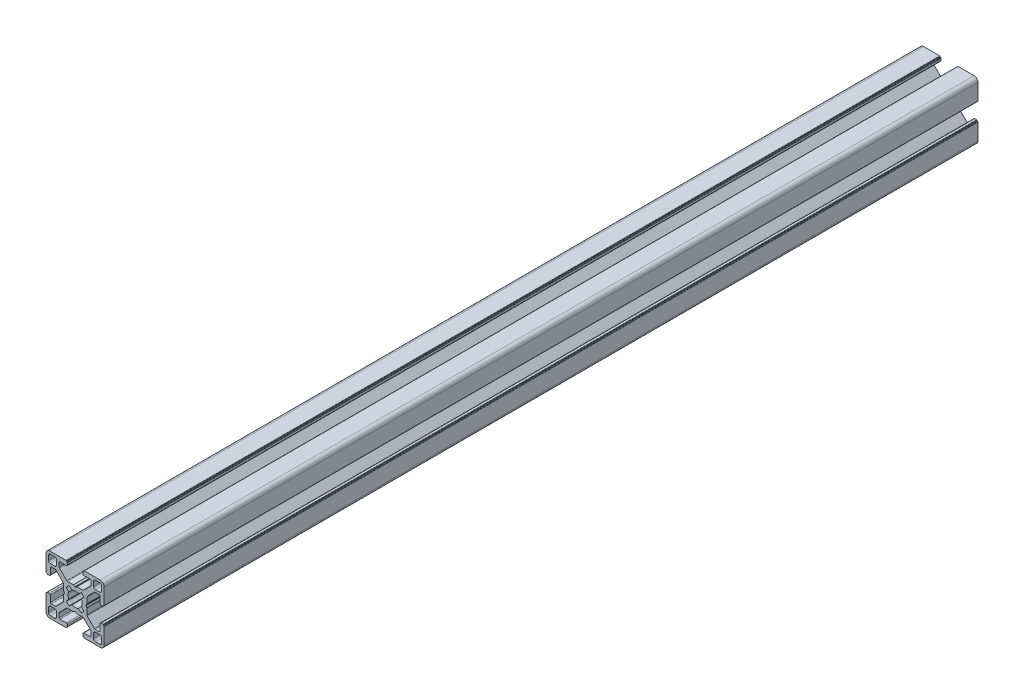
from build123d import *

# Parameters (mm, degrees)
SALIENTE_EXTRUIR1_DEPTH = 1000
CORTAR_EXTRUIR1_START   = -550
CORTAR_EXTRUIR1_DEPTH   = 550


with BuildPart() as part:
    # Croquis1 → Saliente-Extruir1 (new body)
    with BuildSketch(Plane.XY.offset(1000)):
        with BuildLine():
            Line((9.800000436, -10.500000436), (10.100000436, -10.500000436))
            ThreePointArc((10.100000436, -10.500000436), (10.241421792, -10.441421792), (10.300000436, -10.300000436))
            Line((10.300000436, -10.300000436), (10.300000436, -2))
            ThreePointArc((10.300000436, -2), (9.714213998, -0.585786438), (8.300000436, 0))
            Line((8.300000436, 0), (0, 0))
            ThreePointArc((0, 0), (-0.141421356, -0.058578644), (-0.2, -0.2))
            Line((-0.2, -0.2), (-0.2, -0.5))
            Line((-0.2, -0.5), (-0.49999919, -0.5))
            ThreePointArc((-0.49999919, -0.5), (-0.641420811, -0.558578753), (-0.699999564, -0.700000374))
            Line((-0.699999564, -0.700000374), (-0.699999564, -1.700000763))
            ThreePointArc((-0.699999564, -1.700000763), (-0.553552955, -2.053554154), (-0.199999564, -2.200000763))
            Line((-0.199999564, -2.200000763), (3.050000763, -2.200000763))
            ThreePointArc((3.050000763, -2.200000763), (3.403554154, -2.346447372), (3.550000763, -2.700000763))
            Line((3.550000763, -2.700000763), (3.550000763, -4.743055509))
            ThreePointArc((3.550000763, -4.743055509), (3.511993279, -4.934269826), (3.403749103, -5.096413843))
            Line((3.403749103, -5.096413843), (-0.349053376, -8.853358334))
            ThreePointArc((-0.349053376, -8.853358334), (-0.511332616, -8.961886981), (-0.702801716, -9))
            Line((-0.702801716, -9), (-3.746809419, -9))
            ThreePointArc((-3.746809419, -9), (-3.798212795, -9.006718618), (-3.846162576, -9.026423071))
            Line((-3.846162576, -9.026423071), (-4.600646407, -9.458279719))
            ThreePointArc((-4.600646407, -9.458279719), (-4.699999564, -9.48470279), (-4.799352721, -9.458279719))
            Line((-4.799352721, -9.458279719), (-5.553836552, -9.026423071))
            ThreePointArc((-5.553836552, -9.026423071), (-5.601786333, -9.006718618), (-5.653189709, -9))
            Line((-5.653189709, -9), (-8.697197412, -9))
            ThreePointArc((-8.697197412, -9), (-8.888666513, -8.961886981), (-9.050945752, -8.853358334))
            Line((-9.050945752, -8.853358334), (-12.803748231, -5.096413843))
            ThreePointArc((-12.803748231, -5.096413843), (-12.911992407, -4.934269826), (-12.949999891, -4.743055509))
            Line((-12.949999891, -4.743055509), (-12.949999891, -2.700000763))
            ThreePointArc((-12.949999891, -2.700000763), (-12.803553282, -2.346447372), (-12.449999891, -2.200000763))
            Line((-12.449999891, -2.200000763), (-9.199999564, -2.200000763))
            ThreePointArc((-9.199999564, -2.200000763), (-8.846446173, -2.053554154), (-8.699999564, -1.700000763))
            Line((-8.699999564, -1.700000763), (-8.699999564, -0.700000374))
            ThreePointArc((-8.699999564, -0.700000374), (-8.758578317, -0.558578753), (-8.899999938, -0.5))
            Line((-8.899999938, -0.5), (-9.199999128, -0.5))
            Line((-9.199999128, -0.5), (-9.199999128, -0.2))
            ThreePointArc((-9.199999128, -0.2), (-9.258577772, -0.058578644), (-9.399999128, 0))
            Line((-9.399999128, 0), (-17.699999564, 0))
            ThreePointArc((-17.699999564, 0), (-19.114213126, -0.585786438), (-19.699999564, -2))
            Line((-19.699999564, -2), (-19.699999564, -10.300000436))
            ThreePointArc((-19.699999564, -10.300000436), (-19.64142092, -10.441421792), (-19.499999564, -10.500000436))
            Line((-19.499999564, -10.500000436), (-19.199999564, -10.500000436))
            Line((-19.199999564, -10.500000436), (-19.199999564, -10.799999627))
            ThreePointArc((-19.199999564, -10.799999627), (-19.141420811, -10.941421247), (-18.99999919, -11))
            Line((-18.99999919, -11), (-17.999998801, -11))
            ThreePointArc((-17.999998801, -11), (-17.64644541, -10.853553391), (-17.499998801, -10.5))
            Line((-17.499998801, -10.5), (-17.499998801, -7.249999673))
            ThreePointArc((-17.499998801, -7.249999673), (-17.353552192, -6.896446283), (-16.999998801, -6.749999673))
            Line((-16.999998801, -6.749999673), (-14.956944055, -6.749999673))
            ThreePointArc((-14.956944055, -6.749999673), (-14.765729738, -6.788007157), (-14.603585721, -6.896251334))
            Line((-14.603585721, -6.896251334), (-10.84664123, -10.649053813))
            ThreePointArc((-10.84664123, -10.649053813), (-10.738112583, -10.811333052), (-10.699999564, -11.002802152))
            Line((-10.699999564, -11.002802152), (-10.699999564, -14.046809855))
            ThreePointArc((-10.699999564, -14.046809855), (-10.693280947, -14.098213232), (-10.673576493, -14.146163012))
            Line((-10.673576493, -14.146163012), (-10.241719845, -14.900646843))
            ThreePointArc((-10.241719845, -14.900646843), (-10.215296774, -15), (-10.241719845, -15.099353157))
            Line((-10.241719845, -15.099353157), (-10.673576493, -15.853836988))
            ThreePointArc((-10.673576493, -15.853836988), (-10.693280947, -15.901786769), (-10.699999564, -15.953190146))
            Line((-10.699999564, -15.953190146), (-10.699999564, -18.997197848))
            ThreePointArc((-10.699999564, -18.997197848), (-10.738112583, -19.188666949), (-10.84664123, -19.350946188))
            Line((-10.84664123, -19.350946188), (-14.603585721, -23.103748667))
            ThreePointArc((-14.603585721, -23.103748667), (-14.765729738, -23.211992843), (-14.956944055, -23.250000327))
            Line((-14.956944055, -23.250000327), (-16.999998801, -23.250000327))
            ThreePointArc((-16.999998801, -23.250000327), (-17.353552192, -23.103553718), (-17.499998801, -22.750000327))
            Line((-17.499998801, -22.750000327), (-17.499998801, -19.5))
            ThreePointArc((-17.499998801, -19.5), (-17.64644541, -19.14644661), (-17.999998801, -19))
            Line((-17.999998801, -19), (-18.99999919, -19))
            ThreePointArc((-18.99999919, -19), (-19.141420811, -19.058578753), (-19.199999564, -19.200000374))
            Line((-19.199999564, -19.200000374), (-19.199999564, -19.499999564))
            Line((-19.199999564, -19.499999564), (-19.499999564, -19.499999564))
            ThreePointArc((-19.499999564, -19.499999564), (-19.64142092, -19.558578208), (-19.699999564, -19.699999564))
            Line((-19.699999564, -19.699999564), (-19.699999564, -28))
            ThreePointArc((-19.699999564, -28), (-19.114213126, -29.414213563), (-17.699999564, -30))
            Line((-17.699999564, -30), (-9.399999128, -30))
            ThreePointArc((-9.399999128, -30), (-9.258577772, -29.941421356), (-9.199999128, -29.8))
            Line((-9.199999128, -29.8), (-9.199999128, -29.5))
            Line((-9.199999128, -29.5), (-8.899999938, -29.5))
            ThreePointArc((-8.899999938, -29.5), (-8.758578317, -29.441421247), (-8.699999564, -29.299999627))
            Line((-8.699999564, -29.299999627), (-8.699999564, -28.299999237))
            ThreePointArc((-8.699999564, -28.299999237), (-8.846446173, -27.946445847), (-9.199999564, -27.799999237))
            Line((-9.199999564, -27.799999237), (-12.449999891, -27.799999237))
            ThreePointArc((-12.449999891, -27.799999237), (-12.803553282, -27.653552628), (-12.949999891, -27.299999237))
            Line((-12.949999891, -27.299999237), (-12.949999891, -25.256944491))
            ThreePointArc((-12.949999891, -25.256944491), (-12.911992407, -25.065730174), (-12.803748231, -24.903586157))
            Line((-12.803748231, -24.903586157), (-9.050945752, -21.146641666))
            ThreePointArc((-9.050945752, -21.146641666), (-8.888666513, -21.038113019), (-8.697197412, -21))
            Line((-8.697197412, -21), (-5.653189709, -21))
            ThreePointArc((-5.653189709, -21), (-5.601786333, -20.993281383), (-5.553836552, -20.973576929))
            Line((-5.553836552, -20.973576929), (-4.799352721, -20.541720281))
            ThreePointArc((-4.799352721, -20.541720281), (-4.699999564, -20.51529721), (-4.600646407, -20.541720281))
            Line((-4.600646407, -20.541720281), (-3.846162576, -20.973576929))
            ThreePointArc((-3.846162576, -20.973576929), (-3.798212795, -20.993281383), (-3.746809419, -21))
            Line((-3.746809419, -21), (-0.702801716, -21))
            ThreePointArc((-0.702801716, -21), (-0.511332616, -21.038113019), (-0.349053377, -21.146641666))
            Line((-0.349053377, -21.146641666), (3.403749103, -24.903586157))
            ThreePointArc((3.403749103, -24.903586157), (3.511993279, -25.065730174), (3.550000763, -25.256944491))
            Line((3.550000763, -25.256944491), (3.550000763, -27.299999237))
            ThreePointArc((3.550000763, -27.299999237), (3.403554154, -27.653552628), (3.050000763, -27.799999237))
            Line((3.050000763, -27.799999237), (-0.199999564, -27.799999237))
            ThreePointArc((-0.199999564, -27.799999237), (-0.553552955, -27.946445847), (-0.699999564, -28.299999237))
            Line((-0.699999564, -28.299999237), (-0.699999564, -29.299999627))
            ThreePointArc((-0.699999564, -29.299999627), (-0.641420811, -29.441421247), (-0.49999919, -29.5))
            Line((-0.49999919, -29.5), (-0.2, -29.5))
            Line((-0.2, -29.5), (-0.2, -29.8))
            ThreePointArc((-0.2, -29.8), (-0.141421356, -29.941421356), (0, -30))
            Line((0, -30), (8.300000436, -30))
            ThreePointArc((8.300000436, -30), (9.714213998, -29.414213563), (10.300000436, -28))
            Line((10.300000436, -28), (10.300000436, -19.699999564))
            ThreePointArc((10.300000436, -19.699999564), (10.241421792, -19.558578208), (10.100000436, -19.499999564))
            Line((10.100000436, -19.499999564), (9.800000436, -19.499999564))
            Line((9.800000436, -19.499999564), (9.800000436, -19.200000374))
            ThreePointArc((9.800000436, -19.200000374), (9.741421683, -19.058578753), (9.600000062, -19))
            Line((9.600000062, -19), (8.599999673, -19))
            ThreePointArc((8.599999673, -19), (8.246446283, -19.14644661), (8.099999673, -19.5))
            Line((8.099999673, -19.5), (8.099999673, -22.750000327))
            ThreePointArc((8.099999673, -22.750000327), (7.953553064, -23.103553718), (7.599999673, -23.250000327))
            Line((7.599999673, -23.250000327), (5.556944927, -23.250000327))
            ThreePointArc((5.556944927, -23.250000327), (5.36573061, -23.211992843), (5.203586593, -23.103748667))
            Line((5.203586593, -23.103748667), (1.446642102, -19.350946188))
            ThreePointArc((1.446642102, -19.350946188), (1.338113455, -19.188666949), (1.300000436, -18.997197848))
            Line((1.300000436, -18.997197848), (1.300000436, -15.953190145))
            ThreePointArc((1.300000436, -15.953190145), (1.293281819, -15.901786769), (1.273577365, -15.853836988))
            Line((1.273577365, -15.853836988), (0.841720717, -15.099353157))
            ThreePointArc((0.841720717, -15.099353157), (0.815297646, -15), (0.841720717, -14.900646843))
            Line((0.841720717, -14.900646843), (1.273577365, -14.146163012))
            ThreePointArc((1.273577365, -14.146163012), (1.293281819, -14.098213231), (1.300000436, -14.046809855))
            Line((1.300000436, -14.046809855), (1.300000436, -11.002802152))
            ThreePointArc((1.300000436, -11.002802152), (1.338113455, -10.811333051), (1.446642102, -10.649053812))
            Line((1.446642102, -10.649053812), (5.203586593, -6.896251334))
            ThreePointArc((5.203586593, -6.896251334), (5.36573061, -6.788007157), (5.556944927, -6.749999673))
            Line((5.556944927, -6.749999673), (7.599999673, -6.749999673))
            ThreePointArc((7.599999673, -6.749999673), (7.953553064, -6.896446283), (8.099999673, -7.249999673))
            Line((8.099999673, -7.249999673), (8.099999673, -10.5))
            ThreePointArc((8.099999673, -10.5), (8.246446283, -10.853553391), (8.599999673, -11))
            Line((8.599999673, -11), (9.600000062, -11))
            ThreePointArc((9.600000062, -11), (9.741421683, -10.941421247), (9.800000436, -10.799999627))
            Line((9.800000436, -10.799999627), (9.800000436, -10.500000436))
        make_face()
        with BuildLine():
            Line((8.000001536, -5.500000365), (5.800000754, -5.500000365))
            ThreePointArc((5.800000754, -5.500000365), (5.092893979, -5.207107149), (4.800000763, -4.500000374))
            Line((4.800000763, -4.500000374), (4.800000763, -2.299999592))
            ThreePointArc((4.800000763, -2.299999592), (5.092893979, -1.592892818), (5.800000754, -1.299999602))
            Line((5.800000754, -1.299999602), (8.000001536, -1.299999602))
            ThreePointArc((8.000001536, -1.299999602), (8.70710831, -1.592892818), (9.000001526, -2.299999592))
            Line((9.000001526, -2.299999592), (9.000001526, -4.500000374))
            ThreePointArc((9.000001526, -4.500000374), (8.70710831, -5.207107149), (8.000001536, -5.500000365))
        make_face(mode=Mode.SUBTRACT)
        with BuildLine():
            Line((-15.199999881, -5.500000365), (-17.400000663, -5.500000365))
            ThreePointArc((-17.400000663, -5.500000365), (-18.107107438, -5.207107149), (-18.400000654, -4.500000374))
            Line((-18.400000654, -4.500000374), (-18.400000654, -2.299999592))
            ThreePointArc((-18.400000654, -2.299999592), (-18.107107438, -1.592892818), (-17.400000664, -1.299999602))
            Line((-17.400000664, -1.299999602), (-15.199999881, -1.299999602))
            ThreePointArc((-15.199999881, -1.299999602), (-14.492893107, -1.592892818), (-14.199999891, -2.299999592))
            Line((-14.199999891, -2.299999592), (-14.199999891, -4.500000374))
            ThreePointArc((-14.199999891, -4.500000374), (-14.492893107, -5.207107149), (-15.199999881, -5.500000365))
        make_face(mode=Mode.SUBTRACT)
        with BuildLine():
            Line((-17.400000664, -24.499999636), (-15.199999881, -24.499999636))
            ThreePointArc((-15.199999881, -24.499999636), (-14.492893107, -24.792892852), (-14.199999891, -25.499999626))
            Line((-14.199999891, -25.499999626), (-14.199999891, -27.700000408))
            ThreePointArc((-14.199999891, -27.700000408), (-14.492893107, -28.407107183), (-15.199999881, -28.700000399))
            Line((-15.199999881, -28.700000399), (-17.400000663, -28.700000399))
            ThreePointArc((-17.400000663, -28.700000399), (-18.107107438, -28.407107183), (-18.400000654, -27.700000408))
            Line((-18.400000654, -27.700000408), (-18.400000654, -25.499999626))
            ThreePointArc((-18.400000654, -25.499999626), (-18.107107438, -24.792892852), (-17.400000664, -24.499999636))
        make_face(mode=Mode.SUBTRACT)
        with BuildLine():
            Line((5.800000754, -24.499999636), (8.000001536, -24.499999636))
            ThreePointArc((8.000001536, -24.499999636), (8.70710831, -24.792892852), (9.000001526, -25.499999626))
            Line((9.000001526, -25.499999626), (9.000001526, -27.700000408))
            ThreePointArc((9.000001526, -27.700000408), (8.70710831, -28.407107183), (8.000001536, -28.700000399))
            Line((8.000001536, -28.700000399), (5.800000754, -28.700000399))
            ThreePointArc((5.800000754, -28.700000399), (5.092893979, -28.407107183), (4.800000763, -27.700000408))
            Line((4.800000763, -27.700000408), (4.800000763, -25.499999626))
            ThreePointArc((4.800000763, -25.499999626), (5.092893979, -24.792892852), (5.800000754, -24.499999636))
        make_face(mode=Mode.SUBTRACT)
        with BuildLine():
            Line((-7.835928976, -10.481599097), (-6.300129088, -11.719438233))
            ThreePointArc((-6.300129088, -11.719438233), (-4.699999564, -11.35), (-3.09987004, -11.719438233))
            Line((-3.09987004, -11.719438233), (-1.564070152, -10.481599097))
            ThreePointArc((-1.564070152, -10.481599097), (-0.818997305, -11.10284444), (-0.194662672, -11.845330527))
            Line((-0.194662672, -11.845330527), (-1.419437832, -13.399870404))
            ThreePointArc((-1.419437832, -13.399870404), (-1.049999564, -15), (-1.419437832, -16.600129597))
            Line((-1.419437832, -16.600129597), (-0.194662672, -18.154669473))
            ThreePointArc((-0.194662672, -18.154669473), (-0.818997305, -18.897155561), (-1.564070152, -19.518400903))
            Line((-1.564070152, -19.518400903), (-3.09987004, -18.280561767))
            ThreePointArc((-3.09987004, -18.280561767), (-4.699999564, -18.65), (-6.300129088, -18.280561767))
            Line((-6.300129088, -18.280561767), (-7.835928976, -19.518400903))
            ThreePointArc((-7.835928976, -19.518400903), (-8.581001823, -18.897155561), (-9.205336456, -18.154669473))
            Line((-9.205336456, -18.154669473), (-7.980561295, -16.600129597))
            ThreePointArc((-7.980561295, -16.600129597), (-8.349999564, -15), (-7.980561296, -13.399870404))
            Line((-7.980561296, -13.399870404), (-9.205336456, -11.845330527))
            ThreePointArc((-9.205336456, -11.845330527), (-8.581001823, -11.10284444), (-7.835928976, -10.481599097))
        make_face(mode=Mode.SUBTRACT)
    extrude(amount=-SALIENTE_EXTRUIR1_DEPTH)

    # Croquis4 → Cortar-Extruir1 (cut)
    with BuildSketch(Plane(origin=(0, 0, 0), x_dir=(-1, 0, 0), z_dir=(0, 0, -1)).offset(CORTAR_EXTRUIR1_START)):
        with BuildLine():
            Line((-9.800000436, -10.500000436), (-9.800000436, -10.799999627))
            ThreePointArc((-9.800000436, -10.799999627), (-9.741421683, -10.941421247), (-9.600000062, -11))
            Line((-9.600000062, -11), (-8.599999673, -11))
            ThreePointArc((-8.599999673, -11), (-8.246446283, -10.853553391), (-8.099999673, -10.5))
            Line((-8.099999673, -10.5), (-8.099999673, -7.249999673))
            ThreePointArc((-8.099999673, -7.249999673), (-7.953553064, -6.896446283), (-7.599999673, -6.749999673))
            Line((-7.599999673, -6.749999673), (-5.556944927, -6.749999673))
            ThreePointArc((-5.556944927, -6.749999673), (-5.36573061, -6.788007157), (-5.203586593, -6.896251334))
            Line((-5.203586593, -6.896251334), (-1.446642102, -10.649053812))
            ThreePointArc((-1.446642102, -10.649053812), (-1.338113455, -10.811333051), (-1.300000436, -11.002802152))
            Line((-1.300000436, -11.002802152), (-1.300000436, -14.046809855))
            ThreePointArc((-1.300000436, -14.046809855), (-1.293281819, -14.098213231), (-1.273577365, -14.146163012))
            Line((-1.273577365, -14.146163012), (-0.841720717, -14.900646843))
            ThreePointArc((-0.841720717, -14.900646843), (-0.815297646, -15), (-0.841720717, -15.099353157))
            Line((-0.841720717, -15.099353157), (-1.273577365, -15.853836988))
            ThreePointArc((-1.273577365, -15.853836988), (-1.293281819, -15.901786769), (-1.300000436, -15.953190145))
            Line((-1.300000436, -15.953190145), (-1.300000436, -18.997197848))
            ThreePointArc((-1.300000436, -18.997197848), (-1.338113455, -19.188666949), (-1.446642102, -19.350946188))
            Line((-1.446642102, -19.350946188), (-5.203586593, -23.103748667))
            ThreePointArc((-5.203586593, -23.103748667), (-5.36573061, -23.211992843), (-5.556944927, -23.250000327))
            Line((-5.556944927, -23.250000327), (-7.599999673, -23.250000327))
            ThreePointArc((-7.599999673, -23.250000327), (-7.953553064, -23.103553718), (-8.099999673, -22.750000327))
            Line((-8.099999673, -22.750000327), (-8.099999673, -19.5))
            ThreePointArc((-8.099999673, -19.5), (-8.246446283, -19.14644661), (-8.599999673, -19))
            Line((-8.599999673, -19), (-9.600000062, -19))
            ThreePointArc((-9.600000062, -19), (-9.741421683, -19.058578753), (-9.800000436, -19.200000374))
            Line((-9.800000436, -19.200000374), (-9.800000436, -19.499999564))
            Line((-9.800000436, -19.499999564), (-10.100000436, -19.499999564))
            ThreePointArc((-10.100000436, -19.499999564), (-10.241421792, -19.558578208), (-10.300000436, -19.699999564))
            Line((-10.300000436, -19.699999564), (-10.300000436, -28))
            ThreePointArc((-10.300000436, -28), (-9.714213998, -29.414213563), (-8.300000436, -30))
            Line((-8.300000436, -30), (0, -30))
            ThreePointArc((0, -30), (0.141421356, -29.941421356), (0.2, -29.8))
            Line((0.2, -29.8), (0.2, -29.5))
            Line((0.2, -29.5), (0.49999919, -29.5))
            ThreePointArc((0.49999919, -29.5), (0.641420811, -29.441421247), (0.699999564, -29.299999627))
            Line((0.699999564, -29.299999627), (0.699999564, -28.299999237))
            ThreePointArc((0.699999564, -28.299999237), (0.553552955, -27.946445847), (0.199999564, -27.799999237))
            Line((0.199999564, -27.799999237), (-3.050000763, -27.799999237))
            ThreePointArc((-3.050000763, -27.799999237), (-3.403554154, -27.653552628), (-3.550000763, -27.299999237))
            Line((-3.550000763, -27.299999237), (-3.550000763, -25.256944491))
            ThreePointArc((-3.550000763, -25.256944491), (-3.511993279, -25.065730174), (-3.403749103, -24.903586157))
            Line((-3.403749103, -24.903586157), (0.349053377, -21.146641666))
            ThreePointArc((0.349053377, -21.146641666), (0.511332616, -21.038113019), (0.702801716, -21))
            Line((0.702801716, -21), (3.746809419, -21))
            ThreePointArc((3.746809419, -21), (3.798212795, -20.993281383), (3.846162576, -20.973576929))
            Line((3.846162576, -20.973576929), (4.600646407, -20.541720281))
            ThreePointArc((4.600646407, -20.541720281), (4.699999564, -20.51529721), (4.799352721, -20.541720281))
            Line((4.799352721, -20.541720281), (5.553836552, -20.973576929))
            ThreePointArc((5.553836552, -20.973576929), (5.601786333, -20.993281383), (5.653189709, -21))
            Line((5.653189709, -21), (8.697197412, -21))
            ThreePointArc((8.697197412, -21), (8.888666513, -21.038113019), (9.050945752, -21.146641666))
            Line((9.050945752, -21.146641666), (12.803748231, -24.903586157))
            ThreePointArc((12.803748231, -24.903586157), (12.911992407, -25.065730174), (12.949999891, -25.256944491))
            Line((12.949999891, -25.256944491), (12.949999891, -27.299999237))
            ThreePointArc((12.949999891, -27.299999237), (12.803553282, -27.653552628), (12.449999891, -27.799999237))
            Line((12.449999891, -27.799999237), (9.199999564, -27.799999237))
            ThreePointArc((9.199999564, -27.799999237), (8.846446173, -27.946445847), (8.699999564, -28.299999237))
            Line((8.699999564, -28.299999237), (8.699999564, -29.299999627))
            ThreePointArc((8.699999564, -29.299999627), (8.758578317, -29.441421247), (8.899999938, -29.5))
            Line((8.899999938, -29.5), (9.199999128, -29.5))
            Line((9.199999128, -29.5), (9.199999128, -29.8))
            ThreePointArc((9.199999128, -29.8), (9.258577772, -29.941421356), (9.399999128, -30))
            Line((9.399999128, -30), (17.699999564, -30))
            ThreePointArc((17.699999564, -30), (19.114213126, -29.414213563), (19.699999564, -28))
            Line((19.699999564, -28), (19.699999564, -19.699999564))
            ThreePointArc((19.699999564, -19.699999564), (19.64142092, -19.558578208), (19.499999564, -19.499999564))
            Line((19.499999564, -19.499999564), (19.199999564, -19.499999564))
            Line((19.199999564, -19.499999564), (19.199999564, -19.200000374))
            ThreePointArc((19.199999564, -19.200000374), (19.141420811, -19.058578753), (18.99999919, -19))
            Line((18.99999919, -19), (17.999998801, -19))
            ThreePointArc((17.999998801, -19), (17.64644541, -19.14644661), (17.499998801, -19.5))
            Line((17.499998801, -19.5), (17.499998801, -22.750000327))
            ThreePointArc((17.499998801, -22.750000327), (17.353552192, -23.103553718), (16.999998801, -23.250000327))
            Line((16.999998801, -23.250000327), (14.956944055, -23.250000327))
            ThreePointArc((14.956944055, -23.250000327), (14.765729738, -23.211992843), (14.603585721, -23.103748667))
            Line((14.603585721, -23.103748667), (10.84664123, -19.350946188))
            ThreePointArc((10.84664123, -19.350946188), (10.738112583, -19.188666949), (10.699999564, -18.997197848))
            Line((10.699999564, -18.997197848), (10.699999564, -15.953190146))
            ThreePointArc((10.699999564, -15.953190146), (10.693280947, -15.901786769), (10.673576493, -15.853836988))
            Line((10.673576493, -15.853836988), (10.241719845, -15.099353157))
            ThreePointArc((10.241719845, -15.099353157), (10.215296774, -15), (10.241719845, -14.900646843))
            Line((10.241719845, -14.900646843), (10.673576493, -14.146163012))
            ThreePointArc((10.673576493, -14.146163012), (10.693280947, -14.098213232), (10.699999564, -14.046809855))
            Line((10.699999564, -14.046809855), (10.699999564, -11.002802152))
            ThreePointArc((10.699999564, -11.002802152), (10.738112583, -10.811333052), (10.84664123, -10.649053813))
            Line((10.84664123, -10.649053813), (14.603585721, -6.896251334))
            ThreePointArc((14.603585721, -6.896251334), (14.765729738, -6.788007157), (14.956944055, -6.749999673))
            Line((14.956944055, -6.749999673), (16.999998801, -6.749999673))
            ThreePointArc((16.999998801, -6.749999673), (17.353552192, -6.896446283), (17.499998801, -7.249999673))
            Line((17.499998801, -7.249999673), (17.499998801, -10.5))
            ThreePointArc((17.499998801, -10.5), (17.64644541, -10.853553391), (17.999998801, -11))
            Line((17.999998801, -11), (18.99999919, -11))
            ThreePointArc((18.99999919, -11), (19.141420811, -10.941421247), (19.199999564, -10.799999627))
            Line((19.199999564, -10.799999627), (19.199999564, -10.500000436))
            Line((19.199999564, -10.500000436), (19.499999564, -10.500000436))
            ThreePointArc((19.499999564, -10.500000436), (19.64142092, -10.441421792), (19.699999564, -10.300000436))
            Line((19.699999564, -10.300000436), (19.699999564, -2))
            ThreePointArc((19.699999564, -2), (19.114213126, -0.585786438), (17.699999564, 0))
            Line((17.699999564, 0), (9.399999128, 0))
            ThreePointArc((9.399999128, 0), (9.258577772, -0.058578644), (9.199999128, -0.2))
            Line((9.199999128, -0.2), (9.199999128, -0.5))
            Line((9.199999128, -0.5), (8.899999938, -0.5))
            ThreePointArc((8.899999938, -0.5), (8.758578317, -0.558578753), (8.699999564, -0.700000374))
            Line((8.699999564, -0.700000374), (8.699999564, -1.700000763))
            ThreePointArc((8.699999564, -1.700000763), (8.846446173, -2.053554154), (9.199999564, -2.200000763))
            Line((9.199999564, -2.200000763), (12.449999891, -2.200000763))
            ThreePointArc((12.449999891, -2.200000763), (12.803553282, -2.346447372), (12.949999891, -2.700000763))
            Line((12.949999891, -2.700000763), (12.949999891, -4.743055509))
            ThreePointArc((12.949999891, -4.743055509), (12.911992407, -4.934269826), (12.803748231, -5.096413843))
            Line((12.803748231, -5.096413843), (9.050945752, -8.853358334))
            ThreePointArc((9.050945752, -8.853358334), (8.888666513, -8.961886981), (8.697197412, -9))
            Line((8.697197412, -9), (5.653189709, -9))
            ThreePointArc((5.653189709, -9), (5.601786333, -9.006718618), (5.553836552, -9.026423071))
            Line((5.553836552, -9.026423071), (4.799352721, -9.458279719))
            ThreePointArc((4.799352721, -9.458279719), (4.699999564, -9.48470279), (4.600646407, -9.458279719))
            Line((4.600646407, -9.458279719), (3.846162576, -9.026423071))
            ThreePointArc((3.846162576, -9.026423071), (3.798212795, -9.006718618), (3.746809419, -9))
            Line((3.746809419, -9), (0.702801716, -9))
            ThreePointArc((0.702801716, -9), (0.511332616, -8.961886981), (0.349053376, -8.853358334))
            Line((0.349053376, -8.853358334), (-3.403749103, -5.096413843))
            ThreePointArc((-3.403749103, -5.096413843), (-3.511993279, -4.934269826), (-3.550000763, -4.743055509))
            Line((-3.550000763, -4.743055509), (-3.550000763, -2.700000763))
            ThreePointArc((-3.550000763, -2.700000763), (-3.403554154, -2.346447372), (-3.050000763, -2.200000763))
            Line((-3.050000763, -2.200000763), (0.199999564, -2.200000763))
            ThreePointArc((0.199999564, -2.200000763), (0.553552955, -2.053554154), (0.699999564, -1.700000763))
            Line((0.699999564, -1.700000763), (0.699999564, -0.700000374))
            ThreePointArc((0.699999564, -0.700000374), (0.641420811, -0.558578753), (0.49999919, -0.5))
            Line((0.49999919, -0.5), (0.2, -0.5))
            Line((0.2, -0.5), (0.2, -0.2))
            ThreePointArc((0.2, -0.2), (0.141421356, -0.058578644), (0, 0))
            Line((0, 0), (-8.300000436, 0))
            ThreePointArc((-8.300000436, 0), (-9.714213998, -0.585786438), (-10.300000436, -2))
            Line((-10.300000436, -2), (-10.300000436, -10.300000436))
            ThreePointArc((-10.300000436, -10.300000436), (-10.241421792, -10.441421792), (-10.100000436, -10.500000436))
            Line((-10.100000436, -10.500000436), (-9.800000436, -10.500000436))
        make_face()
    extrude(amount=CORTAR_EXTRUIR1_DEPTH, mode=Mode.SUBTRACT)


solid = part.part
